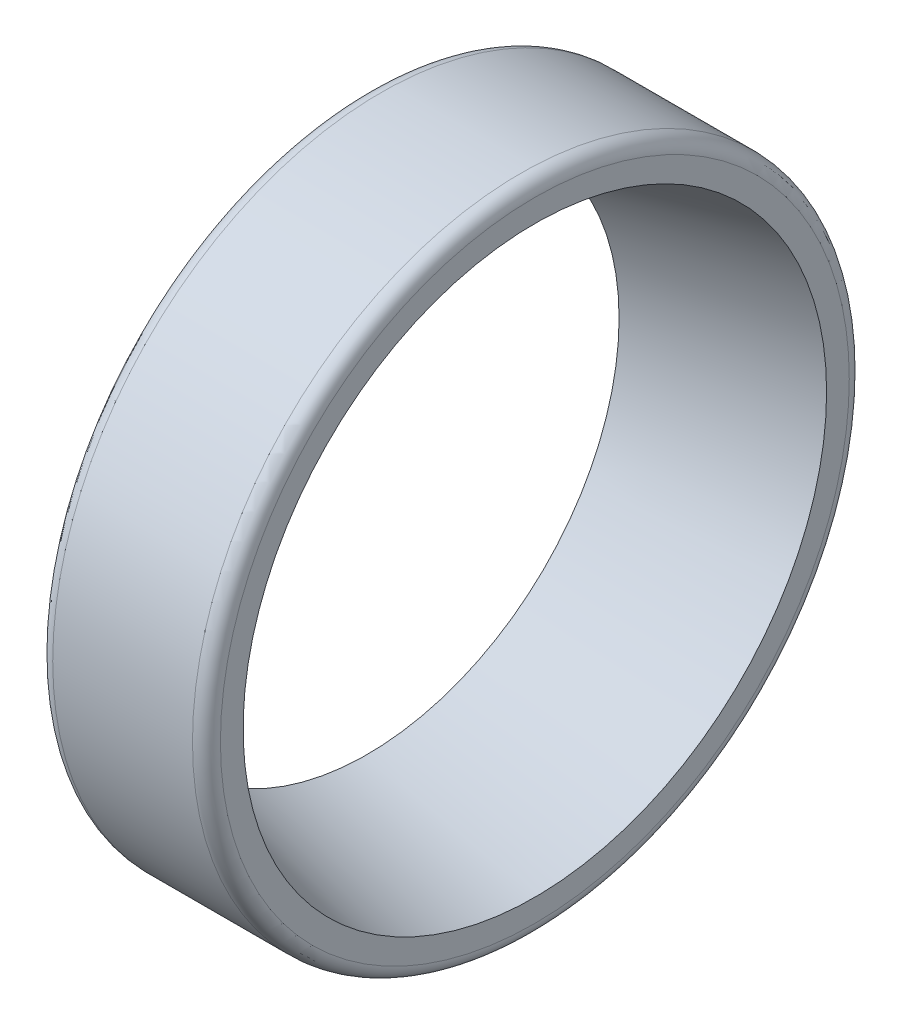
from build123d import *


with BuildPart() as part:
    # ｽｹｯﾁ1 → 回転1 (revolve)
    with BuildSketch(Plane.XY, mode=Mode.PRIVATE) as revolve_1_sk:
        with BuildLine():
            Line((0, 22.5), (0, 18.02838985))
            Line((0, 18.02838985), (12, 20.87738985))
            Line((12, 20.87738985), (12, 22.5))
            ThreePointArc((12, 22.5), (11.707106781, 23.207106781), (11, 23.5))
            Line((11, 23.5), (1, 23.5))
            ThreePointArc((1, 23.5), (0.292893219, 23.207106781), (0, 22.5))
        make_face()
    revolve(revolve_1_sk.sketch.rotate(Axis((-0.001261002, 0, 0), (1, 0, 0)), 270), axis=Axis((-0.001261002, 0, 0), (1, 0, 0)))


solid = part.part
